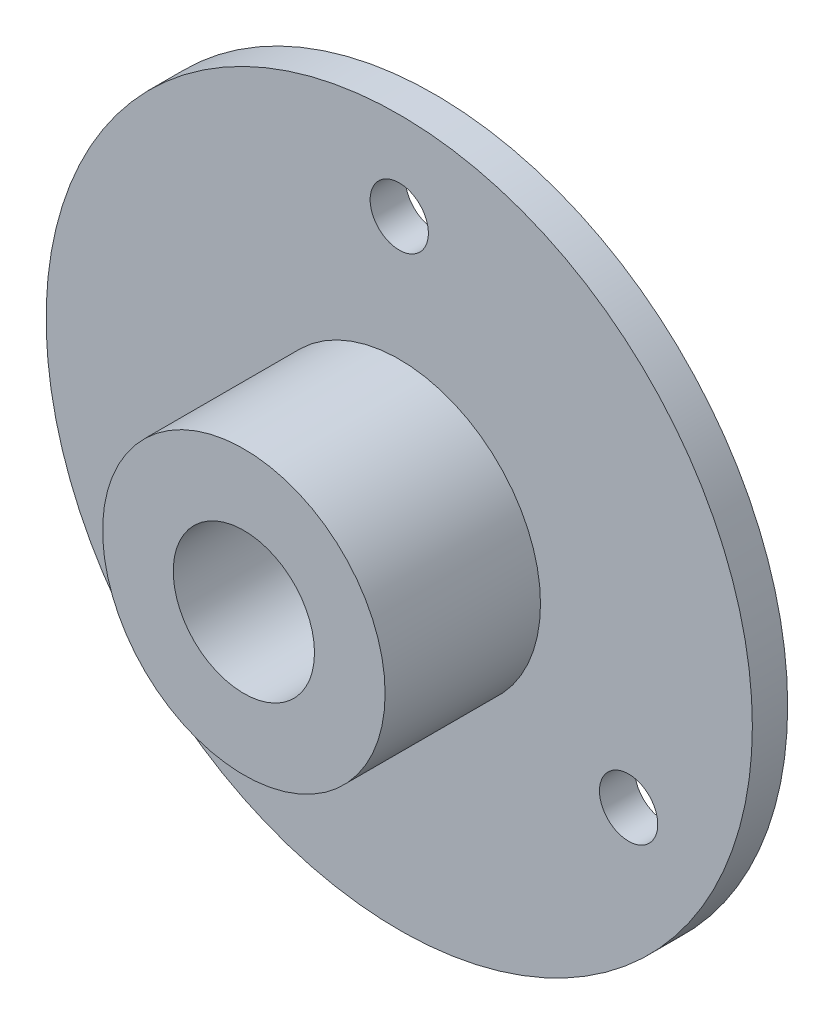
from build123d import *

# Parameters (mm, degrees)
SKETCH_1_R               = 20
EXTRUDE_1_DEPTH          = 2
SKETCH_2_R               = 8
EXTRUDE_2_DEPTH          = 8.8
SKETCH_3_R               = 4
CUT_EXTRUDE_1_DEPTH      = 31.276063152
SKETCH_4_R               = 1.65
CUT_EXTRUDE_2_DEPTH      = 31.276063152
PATTERN_CIRCULAR_1_COUNT = 3


with BuildPart() as part:
    # 草图1 → 凸台-拉伸1 (new body)
    with BuildSketch(Plane.XY):
        Circle(SKETCH_1_R)
    extrude(amount=EXTRUDE_1_DEPTH)

    # 草图2 → 凸台-拉伸2 (add)
    with BuildSketch(Plane.XY.offset(2)):
        Circle(SKETCH_2_R)
    extrude(amount=EXTRUDE_2_DEPTH)

    # 草图3 → 切除-拉伸1 (cut, through all)
    with BuildSketch(Plane.XY.offset(10.8)):
        Circle(SKETCH_3_R)
    extrude(amount=-CUT_EXTRUDE_1_DEPTH, mode=Mode.SUBTRACT)

    # 草图4 → 切除-拉伸2 (cut, through all)
    with BuildSketch(Plane(origin=(0, 0, 0), x_dir=(-1, 0, 0), z_dir=(0, 0, -1))):
        with Locations((0, 15)):
            Circle(SKETCH_4_R)
    cut_extrude_2 = extrude(amount=-CUT_EXTRUDE_2_DEPTH, mode=Mode.SUBTRACT)

    # 阵列(圆周)1: 切除-拉伸2 ×3 about axis
    pattern_circular_1_axis = Axis((0, 0, 0), (0, 0, 1))
    for i in range(1, PATTERN_CIRCULAR_1_COUNT):
        add(cut_extrude_2.rotate(pattern_circular_1_axis, i * 360 / PATTERN_CIRCULAR_1_COUNT), mode=Mode.SUBTRACT)


solid = part.part
